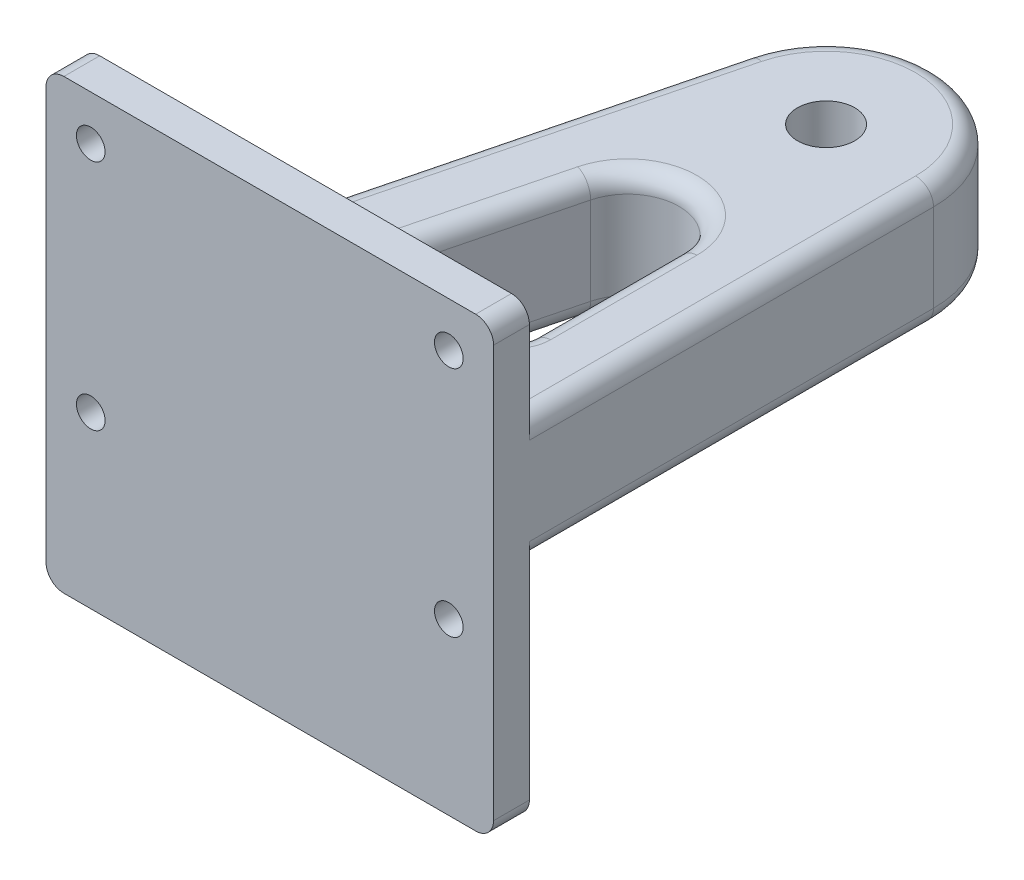
from build123d import *

# Parameters (mm, degrees)
SKETCH1_W            = 25
SKETCH1_H            = 25
BOSS_EXTRUDE1_DEPTH  = 2
SKETCH2_R            = 0.8
CUT_EXTRUDE1_DEPTH   = 18.790446875
LPATTERN1_COUNT      = 2
LPATTERN1_PITCH      = 20
LPATTERN1_COUNT_DIR2 = 2
LPATTERN1_PITCH_DIR2 = 13
SKETCH3_R            = 1.6
BOSS_EXTRUDE2_DEPTH  = 6.9
FILLET1_R            = 1


with BuildPart() as part:
    # Sketch1 → Boss-Extrude1 (new body)
    with BuildSketch(Plane.XY):
        Rectangle(SKETCH1_W, SKETCH1_H)
    extrude(amount=BOSS_EXTRUDE1_DEPTH)

    # Sketch2 → Cut-Extrude1 (cut, through all)
    with BuildSketch(Plane.XY.offset(2)):
        with Locations((-10, 10)):
            Circle(SKETCH2_R)
    cut_extrude1 = extrude(amount=-CUT_EXTRUDE1_DEPTH, mode=Mode.SUBTRACT)

    # LPattern1: Cut-Extrude1 2 × 2
    with Locations(*[(i * LPATTERN1_PITCH, -j * LPATTERN1_PITCH_DIR2, 0) for i in range(LPATTERN1_COUNT) for j in range(LPATTERN1_COUNT_DIR2) if (i, j) != (0, 0)]):
        add(cut_extrude1, mode=Mode.SUBTRACT)

    # Sketch3 → Boss-Extrude2 (add)
    with BuildSketch(Plane(origin=(0, 0, 0), x_dir=(1, 0, 0), z_dir=(0, 1, 0))):
        with BuildLine():
            Line((12.5, 0), (-5.42402052, 0))
            Line((-5.42402052, 0), (0.684667897, 24.049376833))
            ThreePointArc((0.684667897, 24.049376833), (7.244314241, 28.525901035), (12.5, 22.572247005))
            Line((12.5, 22.572247005), (12.5, 0))
        make_face()
        with Locations(Location((6.5, 22.572247005, 0), (0, 0, 90))):
            Circle(SKETCH3_R, mode=Mode.SUBTRACT)
        with BuildLine():
            Line((1.361051754, 3.446753303), (7.227967943, 3.446753303))
            ThreePointArc((7.227967943, 3.446753303), (7.935074725, 3.739646522), (8.227967943, 4.446753303))
            Line((8.227967943, 4.446753303), (8.227967943, 12.628736978))
            ThreePointArc((8.227967943, 12.628736978), (5.718628608, 15.471322881), (2.586710272, 13.333996035))
            Line((2.586710272, 13.333996035), (0.391829737, 4.692941607))
            ThreePointArc((0.391829737, 4.692941607), (0.571688623, 3.832826721), (1.361051754, 3.446753303))
        make_face(mode=Mode.SUBTRACT)
    extrude(amount=BOSS_EXTRUDE2_DEPTH)

    # Fillet1
    fillet1_edges = [part.edges().sort_by_distance(p)[0] for p in [
        (12.5, 6.9, -11.286123503),
        (7.244314241, 6.9, -28.525901035),
        (-2.369676312, 6.9, -12.024688416),
        (8.227967943, 0, -8.53774514),
        (5.718628608, 0, -15.471322881),
        (1.489270004, 0, -9.013468821),
        (0.571688623, 0, -3.832826721),
        (4.294509849, 0, -3.446753303),
        (7.935074725, 0, -3.739646522),
        (12.5, 0, -11.286123503),
        (7.244314241, 0, -28.525901035),
        (-2.369676312, 0, -12.024688416),
        (5.718628608, 6.9, -15.471322881),
        (1.489270004, 6.9, -9.013468821),
        (0.571688623, 6.9, -3.832826721),
        (4.294509849, 6.9, -3.446753303),
        (7.935074725, 6.9, -3.739646522),
        (8.227967943, 6.9, -8.53774514),
        (12.5, -12.5, 1),
        (-12.5, -12.5, 1),
        (-12.5, 12.5, 1),
        (12.5, 12.5, 1),
    ]]
    fillet(fillet1_edges, radius=FILLET1_R)


solid = part.part
